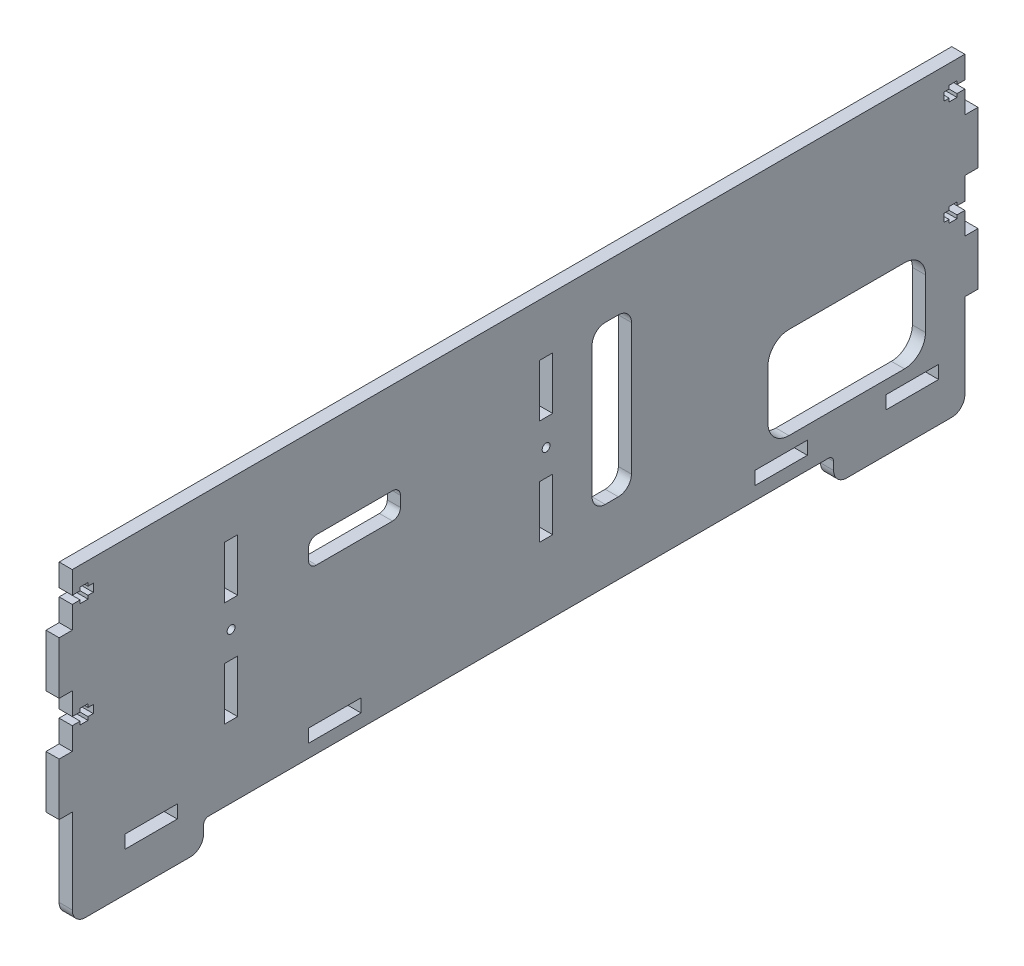
from build123d import *

# Parameters (mm, degrees)
SKETCH_1_R      = 1.5
SKETCH_1_W      = 5
SKETCH_1_H      = 20
SKETCH_1_W_2    = 20
SKETCH_1_H_2    = 5
EXTRUDE_1_DEPTH = 5


with BuildPart() as part:
    # 草图1 → 凸台-拉伸1 (new body)
    with BuildSketch(Plane(origin=(0, 0, 0), x_dir=(0, 0, -1), z_dir=(1, 0, 0))):
        with BuildLine():
            Line((-75.770893239, -36.323671614), (-75.770893239, -33.323671614))
            ThreePointArc((-75.770893239, -33.323671614), (-75.185106801, -31.909458051), (-73.770893239, -31.323671614))
            Line((-73.770893239, -31.323671614), (162.229106761, -31.323671614))
            ThreePointArc((162.229106761, -31.323671614), (163.643320323, -31.909458051), (164.229106761, -33.323671614))
            Line((164.229106761, -33.323671614), (164.229106761, -36.323671614))
            ThreePointArc((164.229106761, -36.323671614), (165.693572855, -39.85920552), (169.229106761, -41.323671614))
            Line((169.229106761, -41.323671614), (209.229106761, -41.323671614))
            ThreePointArc((209.229106761, -41.323671614), (212.764640667, -39.85920552), (214.229106761, -36.323671614))
            Line((214.229106761, -36.323671614), (214.229106761, -4.023671614))
            Line((214.229106761, -4.023671614), (219.229106761, -4.023671614))
            Line((219.229106761, -4.023671614), (219.229106761, 15.976328386))
            Line((219.229106761, 15.976328386), (214.229106761, 15.976328386))
            Line((214.229106761, 15.976328386), (214.229106761, 24.476328386))
            Line((214.229106761, 24.476328386), (211.229106761, 24.476328386))
            Line((211.229106761, 24.476328386), (211.229106761, 23.226328386))
            Line((211.229106761, 23.226328386), (208.229106761, 23.226328386))
            Line((208.229106761, 23.226328386), (208.229106761, 24.476328386))
            Line((208.229106761, 24.476328386), (206.229106761, 24.476328386))
            Line((206.229106761, 24.476328386), (206.229106761, 27.476328386))
            Line((206.229106761, 27.476328386), (208.229106761, 27.476328386))
            Line((208.229106761, 27.476328386), (208.229106761, 28.726328386))
            Line((208.229106761, 28.726328386), (211.229106761, 28.726328386))
            Line((211.229106761, 28.726328386), (211.229106761, 27.476328386))
            Line((211.229106761, 27.476328386), (214.229106761, 27.476328386))
            Line((214.229106761, 27.476328386), (214.229106761, 35.976328386))
            Line((214.229106761, 35.976328386), (219.229106761, 35.976328386))
            Line((219.229106761, 35.976328386), (219.229106761, 55.976328386))
            Line((219.229106761, 55.976328386), (214.229106761, 55.976328386))
            Line((214.229106761, 55.976328386), (214.229106761, 64.476328386))
            Line((214.229106761, 64.476328386), (211.229106761, 64.476328386))
            Line((211.229106761, 64.476328386), (211.229106761, 63.226328386))
            Line((211.229106761, 63.226328386), (208.229106761, 63.226328386))
            Line((208.229106761, 63.226328386), (208.229106761, 64.476328386))
            Line((208.229106761, 64.476328386), (206.229106761, 64.476328386))
            Line((206.229106761, 64.476328386), (206.229106761, 67.476328386))
            Line((206.229106761, 67.476328386), (208.229106761, 67.476328386))
            Line((208.229106761, 67.476328386), (208.229106761, 68.726328386))
            Line((208.229106761, 68.726328386), (211.229106761, 68.726328386))
            Line((211.229106761, 68.726328386), (211.229106761, 67.476328386))
            Line((211.229106761, 67.476328386), (214.229106761, 67.476328386))
            Line((214.229106761, 67.476328386), (214.229106761, 75.976328386))
            Line((214.229106761, 75.976328386), (-125.770893239, 75.976328386))
            Line((-125.770893239, 75.976328386), (-125.770893239, 67.476328386))
            Line((-125.770893239, 67.476328386), (-122.770893239, 67.476328386))
            Line((-122.770893239, 67.476328386), (-122.770893239, 68.726328386))
            Line((-122.770893239, 68.726328386), (-119.770893239, 68.726328386))
            Line((-119.770893239, 68.726328386), (-119.770893239, 67.476328386))
            Line((-119.770893239, 67.476328386), (-117.770893239, 67.476328386))
            Line((-117.770893239, 67.476328386), (-117.770893239, 64.476328386))
            Line((-117.770893239, 64.476328386), (-119.770893239, 64.476328386))
            Line((-119.770893239, 64.476328386), (-119.770893239, 63.226328386))
            Line((-119.770893239, 63.226328386), (-122.770893239, 63.226328386))
            Line((-122.770893239, 63.226328386), (-122.770893239, 64.476328386))
            Line((-122.770893239, 64.476328386), (-125.770893239, 64.476328386))
            Line((-125.770893239, 64.476328386), (-125.770893239, 55.976328386))
            Line((-125.770893239, 55.976328386), (-130.770893239, 55.976328386))
            Line((-130.770893239, 55.976328386), (-130.770893239, 35.976328386))
            Line((-130.770893239, 35.976328386), (-125.770893239, 35.976328386))
            Line((-125.770893239, 35.976328386), (-125.770893239, 27.476328386))
            Line((-125.770893239, 27.476328386), (-122.770893239, 27.476328386))
            Line((-122.770893239, 27.476328386), (-122.770893239, 28.726328386))
            Line((-122.770893239, 28.726328386), (-119.770893239, 28.726328386))
            Line((-119.770893239, 28.726328386), (-119.770893239, 27.476328386))
            Line((-119.770893239, 27.476328386), (-117.770893239, 27.476328386))
            Line((-117.770893239, 27.476328386), (-117.770893239, 24.476328386))
            Line((-117.770893239, 24.476328386), (-119.770893239, 24.476328386))
            Line((-119.770893239, 24.476328386), (-119.770893239, 23.226328386))
            Line((-119.770893239, 23.226328386), (-122.770893239, 23.226328386))
            Line((-122.770893239, 23.226328386), (-122.770893239, 24.476328386))
            Line((-122.770893239, 24.476328386), (-125.770893239, 24.476328386))
            Line((-125.770893239, 24.476328386), (-125.770893239, 15.976328386))
            Line((-125.770893239, 15.976328386), (-130.770893239, 15.976328386))
            Line((-130.770893239, 15.976328386), (-130.770893239, -4.023671614))
            Line((-130.770893239, -4.023671614), (-125.770893239, -4.023671614))
            Line((-125.770893239, -4.023671614), (-125.770893239, -36.323671614))
            ThreePointArc((-125.770893239, -36.323671614), (-124.306427145, -39.85920552), (-120.770893239, -41.323671614))
            Line((-120.770893239, -41.323671614), (-80.770893239, -41.323671614))
            ThreePointArc((-80.770893239, -41.323671614), (-77.235359333, -39.85920552), (-75.770893239, -36.323671614))
        make_face()
        with Locations((54.729106761, 25.976328386)):
            Circle(SKETCH_1_R, mode=Mode.SUBTRACT)
        with Locations((-65.270893239, 25.976328386)):
            Circle(SKETCH_1_R, mode=Mode.SUBTRACT)
        with Locations((54.729106761, 45.976328386)):
            Rectangle(SKETCH_1_W, SKETCH_1_H, mode=Mode.SUBTRACT)
        with Locations((54.729106761, 5.976328386)):
            Rectangle(SKETCH_1_W, SKETCH_1_H, mode=Mode.SUBTRACT)
        with Locations((-65.270893239, 45.976328386)):
            Rectangle(SKETCH_1_W, SKETCH_1_H, mode=Mode.SUBTRACT)
        with Locations((-65.270893239, 5.976328386)):
            Rectangle(SKETCH_1_W, SKETCH_1_H, mode=Mode.SUBTRACT)
        with Locations((-25.770893239, -23.823671614)):
            Rectangle(SKETCH_1_W_2, SKETCH_1_H_2, mode=Mode.SUBTRACT)
        with Locations((-95.770893239, -23.823671614)):
            Rectangle(SKETCH_1_W_2, SKETCH_1_H_2, mode=Mode.SUBTRACT)
        with Locations((194.229106761, -23.823671614)):
            Rectangle(SKETCH_1_W_2, SKETCH_1_H_2, mode=Mode.SUBTRACT)
        with Locations((144.229106761, -23.823671614)):
            Rectangle(SKETCH_1_W_2, SKETCH_1_H_2, mode=Mode.SUBTRACT)
        with BuildLine():
            Line((191.229106761, 18.676328386), (147.229106761, 18.676328386))
            ThreePointArc((147.229106761, 18.676328386), (141.572252511, 16.333182636), (139.229106761, 10.676328386))
            Line((139.229106761, 10.676328386), (139.229106761, -8.323671614))
            ThreePointArc((139.229106761, -8.323671614), (141.572252511, -13.980525863), (147.229106761, -16.323671614))
            Line((147.229106761, -16.323671614), (191.229106761, -16.323671614))
            ThreePointArc((191.229106761, -16.323671614), (196.88596101, -13.980525863), (199.229106761, -8.323671614))
            Line((199.229106761, -8.323671614), (199.229106761, 10.676328386))
            ThreePointArc((199.229106761, 10.676328386), (196.88596101, 16.333182636), (191.229106761, 18.676328386))
        make_face(mode=Mode.SUBTRACT)
        with BuildLine():
            Line((82.229106761, 55.976328386), (77.229106761, 55.976328386))
            ThreePointArc((77.229106761, 55.976328386), (73.693572855, 54.511862292), (72.229106761, 50.976328386))
            Line((72.229106761, 50.976328386), (72.229106761, 0.976328386))
            ThreePointArc((72.229106761, 0.976328386), (73.693572855, -2.55920552), (77.229106761, -4.023671614))
            Line((77.229106761, -4.023671614), (82.229106761, -4.023671614))
            ThreePointArc((82.229106761, -4.023671614), (85.764640667, -2.55920552), (87.229106761, 0.976328386))
            Line((87.229106761, 0.976328386), (87.229106761, 50.976328386))
            ThreePointArc((87.229106761, 50.976328386), (85.764640667, 54.511862292), (82.229106761, 55.976328386))
        make_face(mode=Mode.SUBTRACT)
        with BuildLine():
            Line((-32.770893239, 40.976328386), (-3.770893239, 40.976328386))
            ThreePointArc((-3.770893239, 40.976328386), (-1.649572896, 40.09764873), (-0.770893239, 37.976328386))
            Line((-0.770893239, 37.976328386), (-0.770893239, 33.976328386))
            ThreePointArc((-0.770893239, 33.976328386), (-1.649572896, 31.855008043), (-3.770893239, 30.976328386))
            Line((-3.770893239, 30.976328386), (-32.770893239, 30.976328386))
            ThreePointArc((-32.770893239, 30.976328386), (-34.892213583, 31.855008043), (-35.770893239, 33.976328386))
            Line((-35.770893239, 33.976328386), (-35.770893239, 37.976328386))
            ThreePointArc((-35.770893239, 37.976328386), (-34.892213583, 40.09764873), (-32.770893239, 40.976328386))
        make_face(mode=Mode.SUBTRACT)
    extrude(amount=EXTRUDE_1_DEPTH)


solid = part.part
